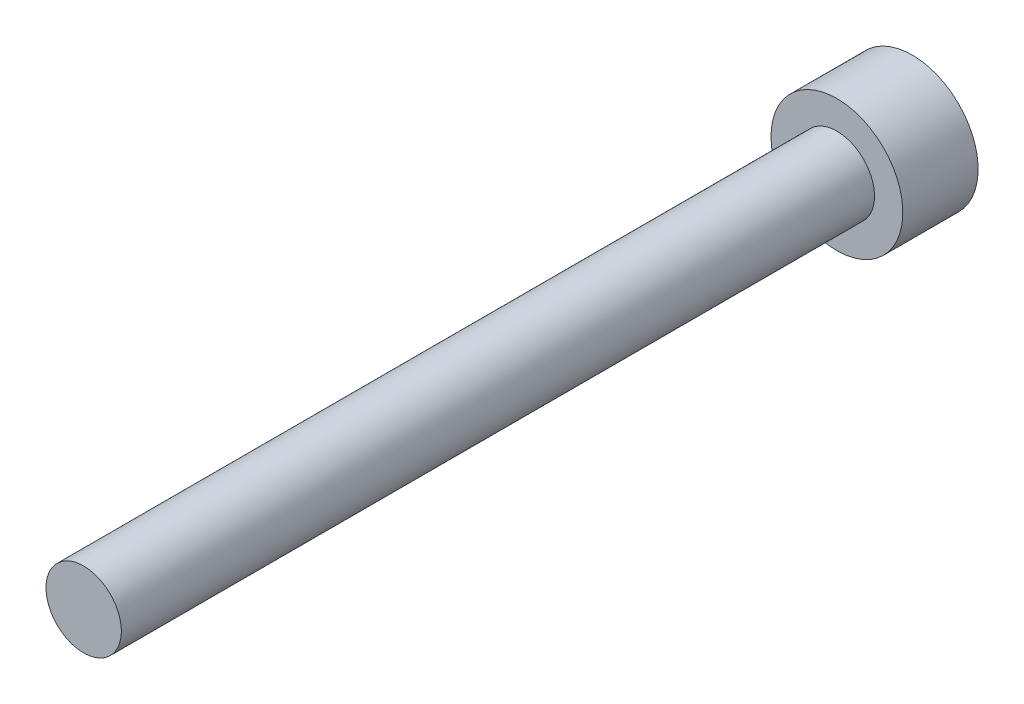
from build123d import *

# Parameters (mm, degrees)
CUT_EXTRUDE1_DEPTH = 3


with BuildPart() as part:
    # Sketch1 → Revolve1 (revolve)
    with BuildSketch(Plane(origin=(0, 0, 0), x_dir=(1, 0, 0), z_dir=(0, 1, 0)), mode=Mode.PRIVATE) as revolve1_sk:
        Polygon((0, 0), (2, 0), (2, 40), (3.5, 40), (3.5, 44), (0, 44), align=None)
    revolve(revolve1_sk.sketch.rotate(Axis((0, 0, -44), (0, 0, 1)), 180), axis=Axis((0, 0, -44), (0, 0, 1)))

    # Sketch2 → Cut-Extrude1 (cut)
    with BuildSketch(Plane(origin=(0, 0, -44), x_dir=(-1, 0, 0), z_dir=(0, 0, -1))):
        Polygon((-0.866025404, -1.5), (0.866025404, -1.5), (1.732050808, 0), (0.866025404, 1.5), (-0.866025404, 1.5), (-1.732050808, 0), align=None)
    extrude(amount=-CUT_EXTRUDE1_DEPTH, mode=Mode.SUBTRACT)


solid = part.part
